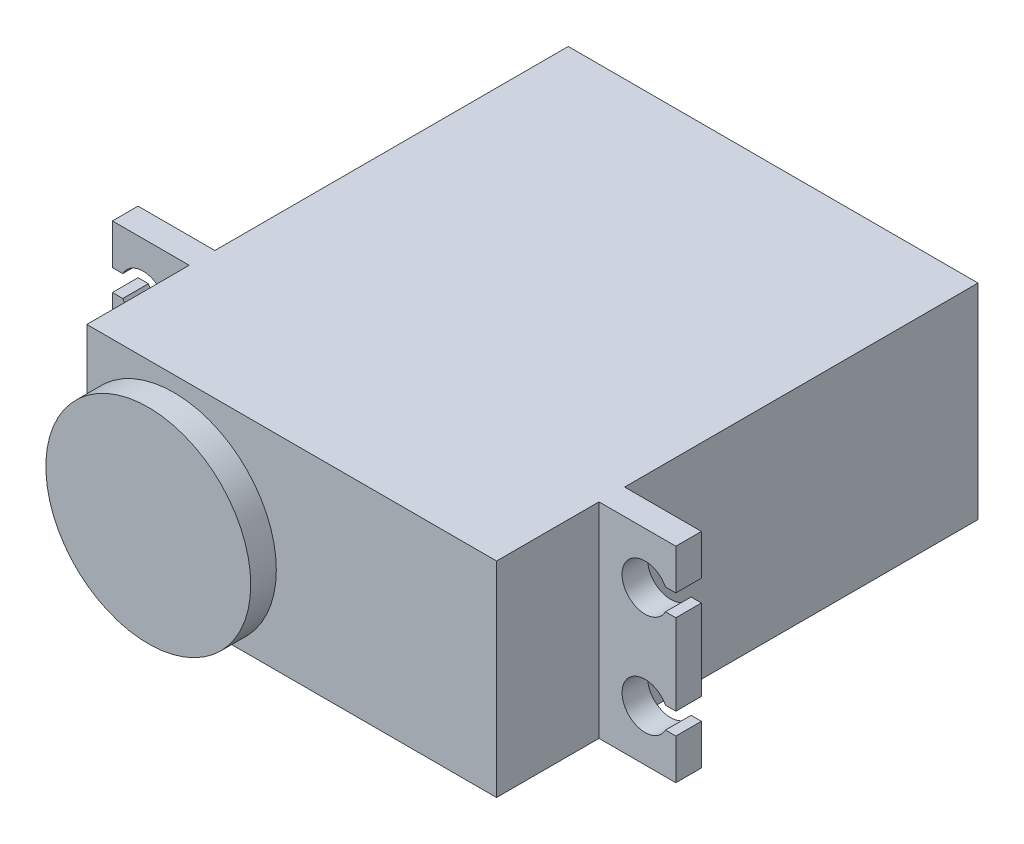
from build123d import *

# Parameters (mm, degrees)
SKETCH1_W           = 47
SKETCH1_H           = 20
BOSS_EXTRUDE1_DEPTH = 40
SKETCH2_R           = 2.95
BOSS_EXTRUDE5_DEPTH = 4
SKETCH5_R           = 10
BOSS_EXTRUDE6_DEPTH = 2.5
SKETCH6_W           = 2.5
SKETCH6_H           = 20
BOSS_EXTRUDE7_DEPTH = 7.5
CUT_EXTRUDE1_REACH  = 60.043
SKETCH7_R           = 2.25


with BuildPart() as part:
    # Sketch1 → Boss-Extrude1 (new body)
    with BuildSketch(Plane(origin=(0, 0, 0), x_dir=(0, 0, -1), z_dir=(1, 0, 0))):
        with Locations((23.5, 10)):
            Rectangle(SKETCH1_W, SKETCH1_H)
    extrude(amount=BOSS_EXTRUDE1_DEPTH)

    # Sketch2 → Boss-Extrude5 (add)
    with BuildSketch(Plane.XY):
        with Locations(Location((10, 10, 0), (0, 0, 180))):
            Circle(SKETCH2_R)
    extrude(amount=BOSS_EXTRUDE5_DEPTH)

    # Sketch5 → Boss-Extrude6 (add)
    with BuildSketch(Plane.XY.offset(4)):
        with Locations((10, 10)):
            Circle(SKETCH5_R)
    extrude(amount=-BOSS_EXTRUDE6_DEPTH)

    # Sketch6 → Boss-Extrude7 (add)
    with BuildSketch(Plane.ZY):
        with Locations((-11.25, 10)):
            Rectangle(SKETCH6_W, SKETCH6_H)
    boss_extrude7 = extrude(amount=BOSS_EXTRUDE7_DEPTH)

    # Sketch7 → Cut-Extrude1 (cut, up to next)
    with BuildSketch(Plane.XY.offset(-10), mode=Mode.PRIVATE) as cut_extrude1_sk1:
        with Locations((-4.5, 15)):
            Circle(SKETCH7_R)
    cut_extrude1_tool1 = extrude(cut_extrude1_sk1.sketch, amount=-CUT_EXTRUDE1_REACH, mode=Mode.PRIVATE) & part.part
    # Sketch7 → Cut-Extrude1 (cut, up to next)
    with BuildSketch(Plane.XY.offset(-10), mode=Mode.PRIVATE) as cut_extrude1_sk2:
        with BuildLine():
            ThreePointArc((-6.489974874, 13.95), (-6.75, 15), (-6.489974874, 16.05))
            Line((-6.489974874, 16.05), (-7.5, 16.05))
            Line((-7.5, 16.05), (-7.5, 13.95))
            Line((-7.5, 13.95), (-6.489974874, 13.95))
        make_face()
    cut_extrude1_tool2 = extrude(cut_extrude1_sk2.sketch, amount=-CUT_EXTRUDE1_REACH, mode=Mode.PRIVATE) & part.part
    # Sketch7 → Cut-Extrude1 (cut, up to next)
    with BuildSketch(Plane.XY.offset(-10), mode=Mode.PRIVATE) as cut_extrude1_sk3:
        with Locations((-4.5, 5)):
            Circle(SKETCH7_R)
    cut_extrude1_tool3 = extrude(cut_extrude1_sk3.sketch, amount=-CUT_EXTRUDE1_REACH, mode=Mode.PRIVATE) & part.part
    # Sketch7 → Cut-Extrude1 (cut, up to next)
    with BuildSketch(Plane.XY.offset(-10), mode=Mode.PRIVATE) as cut_extrude1_sk4:
        with BuildLine():
            Line((-6.489974874, 6.05), (-7.5, 6.05))
            Line((-7.5, 6.05), (-7.5, 3.95))
            Line((-7.5, 3.95), (-6.489974874, 3.95))
            ThreePointArc((-6.489974874, 3.95), (-6.75, 5), (-6.489974874, 6.05))
        make_face()
    cut_extrude1_tool4 = extrude(cut_extrude1_sk4.sketch, amount=-CUT_EXTRUDE1_REACH, mode=Mode.PRIVATE) & part.part
    cut_extrude1_1 = cut_extrude1_tool1.solids().sort_by_distance((-4.5, 15, -10))[0]
    add(cut_extrude1_1, mode=Mode.SUBTRACT)
    cut_extrude1_2 = cut_extrude1_tool2.solids().sort_by_distance((-7.079182, 15, -10))[0]
    add(cut_extrude1_2, mode=Mode.SUBTRACT)
    cut_extrude1_3 = cut_extrude1_tool3.solids().sort_by_distance((-4.5, 5, -10))[0]
    add(cut_extrude1_3, mode=Mode.SUBTRACT)
    cut_extrude1_4 = cut_extrude1_tool4.solids().sort_by_distance((-7.079182, 5, -10))[0]
    add(cut_extrude1_4, mode=Mode.SUBTRACT)
    cut_extrude1 = cut_extrude1_1 + cut_extrude1_2 + cut_extrude1_3 + cut_extrude1_4  # Cut-Extrude1 as one shape, for the pattern or mirror that repeats it

    # Mirror1: Boss-Extrude7, Cut-Extrude1 across plane
    add(boss_extrude7.mirror(Plane(origin=(20, 0, 0), x_dir=(0, 0, 1), z_dir=(1, 0, 0))))
    add(cut_extrude1.mirror(Plane(origin=(20, 0, 0), x_dir=(0, 0, 1), z_dir=(1, 0, 0))), mode=Mode.SUBTRACT)


solid = part.part
